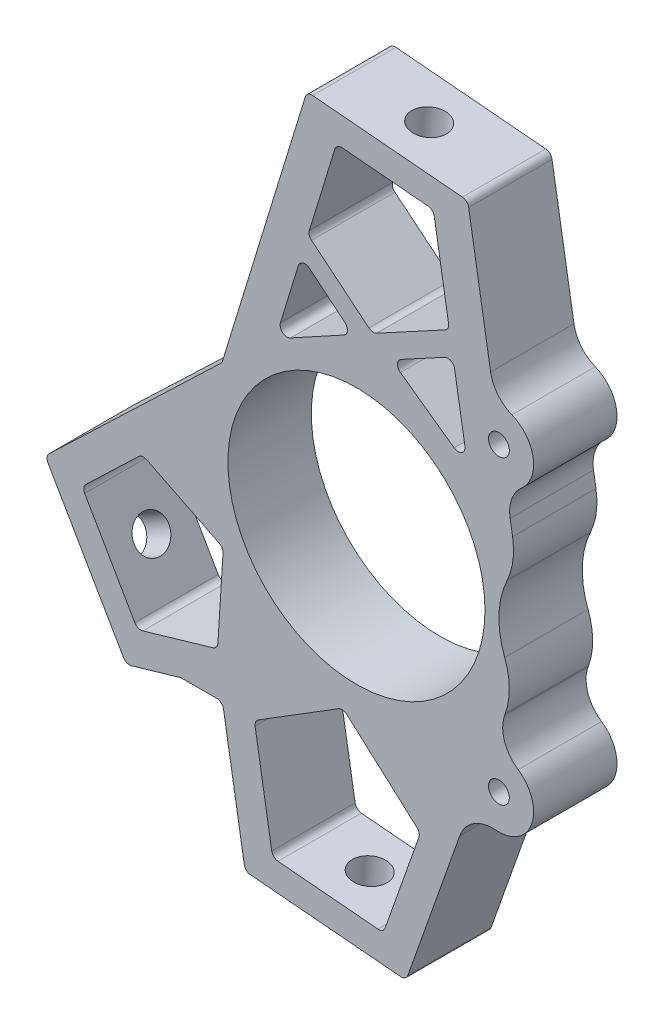
from build123d import *

# Parameters (mm, degrees)
BOSS_EXTRUDE1_DEPTH = 12
SKETCH2_5_R         = 18.5
CUT_EXTRUDE1_DEPTH  = 70.542748898
CUT_EXTRUDE2_DEPTH  = 70.542748898
FILLET2_R           = 1
SKETCH5_R           = 2.5
CUT_EXTRUDE3_DEPTH  = 20
SKETCH6_R           = 2.5
CUT_EXTRUDE4_DEPTH  = 20
SKETCH7_R           = 2.5
CUT_EXTRUDE5_DEPTH  = 20
SKETCH8_R           = 3
CUT_EXTRUDE6_DEPTH  = 12
SKETCH8_5_R         = 5
SKETCH8_5_R_2       = 3
BOSS_EXTRUDE3_DEPTH = 12
SKETCH8_6_R         = 3
BOSS_EXTRUDE4_DEPTH = 3
SKETCH8_7_R         = 1.5
CUT_EXTRUDE7_DEPTH  = 3
CUT_EXTRUDE8_DEPTH  = 12
FILLET3_R           = 10
FILLET4_R           = 5


with BuildPart() as part:
    # Sketch2 → Boss-Extrude1 (new body)
    with BuildSketch(Plane.XY):
        with BuildLine():
            Line((23.672407308, 3.951851747), (16.019679306, 49.793271382))
            Line((16.019679306, 49.793271382), (-7.129793546, 51.818587823))
            Line((-7.129793546, 51.818587823), (-19.353009621, 11.93281278))
            Line((-19.353009621, 11.93281278), (-44.799864735, -12.404358107))
            Line((-44.799864735, -12.404358107), (-33.142421606, -32.595641893))
            Line((-33.142421606, -32.595641893), (-25.274162816, -30.298243696))
            Line((-25.274162816, -30.298243696), (-19.274162816, -30.298243696))
            Line((-19.274162816, -30.298243696), (-16.019679306, -49.793271382))
            Line((-16.019679306, -49.793271382), (7.129793546, -51.818587823))
            Line((7.129793546, -51.818587823), (22.626538395, -8.00248463))
            ThreePointArc((22.626538395, -8.00248463), (23.908672754, -2.091737826), (23.672407308, 3.951851747))
        make_face()
    extrude(amount=BOSS_EXTRUDE1_DEPTH)

    # Sketch2<5> → Cut-Extrude1 (cut, through all)
    with BuildSketch(Plane.XY):
        Circle(SKETCH2_5_R)
    extrude(amount=CUT_EXTRUDE1_DEPTH, mode=Mode.SUBTRACT)

    # Sketch4 → Cut-Extrude2 (cut, through all)
    with BuildSketch(Plane(origin=(0, 0, 0), x_dir=(-1, 0, 0), z_dir=(0, 0, -1))):
        with BuildLine():
            Line((31.89963382, -26.74821348), (39.11444929, -14.25178652))
            ThreePointArc((39.11444929, -14.25178652), (39.238352753, -13.610220853), (38.939597601, -13.029097861))
            Line((38.939597601, -13.029097861), (31.34175024, -5.762576762))
            ThreePointArc((31.34175024, -5.762576762), (30.801372994, -5.49670059), (30.206302215, -5.589374614))
            Line((30.206302215, -5.589374614), (19.760621938, -10.769411482))
            ThreePointArc((19.760621938, -10.769411482), (19.338870845, -11.165302288), (19.206894896, -11.728494852))
            Line((19.206894896, -11.728494852), (19.943691515, -23.364737765))
            ThreePointArc((19.943691515, -23.364737765), (20.160968845, -23.92642119), (20.661412988, -24.261463526))
            Line((20.661412988, -24.261463526), (30.753328537, -27.208131805))
            ThreePointArc((30.753328537, -27.208131805), (31.405973387, -27.176299861), (31.89963382, -26.74821348))
        make_face()
        with BuildLine():
            Line((-3.101588581, -47.450886204), (11.294228399, -46.191415416))
            ThreePointArc((11.294228399, -46.191415416), (11.886017494, -45.929410004), (12.193422961, -45.359881208))
            Line((12.193422961, -45.359881208), (14.590124654, -31.003143578))
            ThreePointArc((14.590124654, -31.003143578), (14.514860423, -30.426266922), (14.131237853, -29.988905397))
            Line((14.131237853, -29.988905397), (2.599081353, -22.829122685))
            ThreePointArc((2.599081353, -22.829122685), (1.984462107, -22.682505678), (1.404640085, -22.933622755))
            Line((1.404640085, -22.933622755), (-8.709033825, -31.987170241))
            ThreePointArc((-8.709033825, -31.987170241), (-9.010881274, -32.484502622), (-8.984828493, -33.065684721))
            Line((-8.984828493, -33.065684721), (-4.131516756, -46.788128366))
            ThreePointArc((-4.131516756, -46.788128366), (-3.729883832, -47.29562434), (-3.101588581, -47.450886204))
        make_face()
        with BuildLine():
            ThreePointArc((3.114153375, 46.657522219), (2.716960749, 47.193739619), (2.070886855, 47.360711488))
            Line((2.070886855, 47.360711488), (-10.298033701, 46.278571159))
            ThreePointArc((-10.298033701, 46.278571159), (-10.889822796, 46.016565746), (-11.197228262, 45.447036951))
            Line((-11.197228262, 45.447036951), (-13.257459336, 33.105827753))
            ThreePointArc((-13.257459336, 33.105827753), (-13.169697178, 32.50237421), (-12.747787491, 32.062089538))
            Line((-12.747787491, 32.062089538), (-2.901922388, 26.723185283))
            ThreePointArc((-2.901922388, 26.723185283), (-2.329564655, 26.606850793), (-1.789845714, 26.830078374))
            Line((-1.789845714, 26.830078374), (6.462299158, 33.620420858))
            ThreePointArc((6.462299158, 33.620420858), (6.784440856, 34.104304755), (6.78301172, 34.68561092))
            Line((6.78301172, 34.68561092), (3.114153375, 46.657522219))
        make_face()
        with BuildLine():
            Line((-6.433365024, 25.225436758), (-12.665126119, 28.604599024))
            ThreePointArc((-12.665126119, 28.604599024), (-13.580597632, 28.624109445), (-14.128154883, 27.890181789))
            Line((-14.128154883, 27.890181789), (-15.611926917, 19.002081175))
            ThreePointArc((-15.611926917, 19.002081175), (-15.15512906, 17.989143487), (-14.044489067, 18.023579629))
            Line((-14.044489067, 18.023579629), (-6.328955938, 23.532517977))
            ThreePointArc((-6.328955938, 23.532517977), (-5.911939917, 24.40791608), (-6.433365024, 25.225436758))
        make_face()
        with BuildLine():
            Line((6.77622527, 29.993656239), (1.666391597, 25.788989304))
            ThreePointArc((1.666391597, 25.788989304), (1.306181331, 24.923189755), (1.821469633, 24.139711446))
            Line((1.821469633, 24.139711446), (9.510194745, 19.929155813))
            ThreePointArc((9.510194745, 19.929155813), (10.622081934, 20.030927743), (10.946625701, 21.099254467))
            Line((10.946625701, 21.099254467), (8.367734263, 29.514477034))
            ThreePointArc((8.367734263, 29.514477034), (7.699924222, 30.179011518), (6.77622527, 29.993656239))
        make_face()
    extrude(amount=-CUT_EXTRUDE2_DEPTH, mode=Mode.SUBTRACT)

    # Fillet2
    fillet2_edges = [part.edges().sort_by_distance(p)[0] for p in [
        (7.129793546, -51.818587823, 6),
        (-16.019679306, -49.793271382, 6),
        (-25.274162816, -30.298243696, 6),
        (-19.274162816, -30.298243696, 6),
        (-33.142421606, -32.595641893, 6),
        (-44.799864735, -12.404358107, 6),
        (-7.129793546, 51.818587823, 6),
        (16.019679306, 49.793271382, 6),
    ]]
    fillet(fillet2_edges, radius=FILLET2_R)

    # Sketch5 → Cut-Extrude3 (cut)
    with BuildSketch(Plane(origin=(-4.44494288, -50.805929603, 0), x_dir=(0.9961946980917458, -0.08715574274765547, 0), z_dir=(-0.08715574274765547, -0.9961946980917458, 0))):
        with Locations((0, 6)):
            Circle(SKETCH5_R)
    extrude(amount=-CUT_EXTRUDE3_DEPTH, mode=Mode.SUBTRACT)

    # Sketch6 → Cut-Extrude4 (cut)
    with BuildSketch(Plane(origin=(-38.97114317, -22.5, 0), x_dir=(0.5000000000000013, -0.8660254037844379, 0), z_dir=(-0.8660254037844378, -0.5000000000000012, 0))):
        with Locations((0, 6)):
            Circle(SKETCH6_R)
    extrude(amount=-CUT_EXTRUDE4_DEPTH, mode=Mode.SUBTRACT)

    # Sketch7 → Cut-Extrude5 (cut)
    with BuildSketch(Plane(origin=(4.44494288, 50.805929603, 0), x_dir=(0.9961946980917453, -0.08715574274766227, 0), z_dir=(0.08715574274766227, 0.9961946980917453, 0))):
        with Locations((0.01731942, -6)):
            Circle(SKETCH7_R)
    extrude(amount=-CUT_EXTRUDE5_DEPTH, mode=Mode.SUBTRACT)

    # Sketch8 → Cut-Extrude6 (cut)
    with BuildSketch(Plane.XY.offset(12)):
        with Locations((20.5, 21.650635095)):
            Circle(SKETCH8_R)
        with Locations((20.5, -21.650635095)):
            Circle(SKETCH8_R)
    extrude(amount=-CUT_EXTRUDE6_DEPTH, mode=Mode.SUBTRACT)

    # Sketch8<5> → Boss-Extrude3 (add)
    # profile 1 of 2: a face of its own
    with BuildSketch(Plane.XY.offset(12)):
        with Locations((20.5, 21.650635095)):
            Circle(SKETCH8_5_R)
        with Locations((20.5, 21.650635095)):
            Circle(SKETCH8_5_R_2, mode=Mode.SUBTRACT)
    # profile 2 of 2: a face of its own
    with BuildSketch(Plane.XY.offset(12)):
        with Locations((20.5, -21.650635095)):
            Circle(SKETCH8_5_R)
        with Locations((20.5, -21.650635095)):
            Circle(SKETCH8_5_R_2, mode=Mode.SUBTRACT)
    extrude(amount=-BOSS_EXTRUDE3_DEPTH)

    # Sketch8<6> → Boss-Extrude4 (add)
    with BuildSketch(Plane.XY.offset(12)):
        with Locations((20.5, 21.650635095)):
            Circle(SKETCH8_6_R)
        with Locations((20.5, -21.650635095)):
            Circle(SKETCH8_6_R)
    extrude(amount=-BOSS_EXTRUDE4_DEPTH)

    # Sketch8<7> → Cut-Extrude7 (cut)
    with BuildSketch(Plane.XY.offset(12)):
        with Locations((20.5, 21.650635095)):
            Circle(SKETCH8_7_R)
        with Locations((20.5, -21.650635095)):
            Circle(SKETCH8_7_R)
    extrude(amount=-CUT_EXTRUDE7_DEPTH, mode=Mode.SUBTRACT)

    # Sketch8<8> → Cut-Extrude8 (cut)
    with BuildSketch(Plane.XY.offset(12)):
        with BuildLine():
            ThreePointArc((30.976333892, 12.335103384), (26.75, 10.825317547), (23.329320166, 7.92009795))
            ThreePointArc((23.329320166, 7.92009795), (20.5, 0), (23.329320166, -7.92009795))
            ThreePointArc((23.329320166, -7.92009795), (26.75, -10.825317547), (30.976333892, -12.335103384))
            ThreePointArc((30.976333892, -12.335103384), (41.091791323, -9.527481996), (45.5, 0))
            ThreePointArc((45.5, 0), (41.091791323, 9.527481996), (30.976333892, 12.335103384))
        make_face()
    extrude(amount=-CUT_EXTRUDE8_DEPTH, mode=Mode.SUBTRACT)

    # Fillet3
    fillet3_edges = [part.edges().sort_by_distance(p)[0] for p in [
        (22.859848485, -7.309399924, 6),
        (23.065610114, 7.586692137, 6),
    ]]
    fillet(fillet3_edges, radius=FILLET3_R)

    # Fillet4
    fillet4_edges = [part.edges().sort_by_distance(p)[0] for p in [
        (16.664875992, -24.85872235, 6),
        (19.534612283, -16.744717591, 6),
        (19.889340166, 26.613204446, 6),
        (21.534424697, 16.758808693, 6),
    ]]
    fillet(fillet4_edges, radius=FILLET4_R)


solid = part.part
